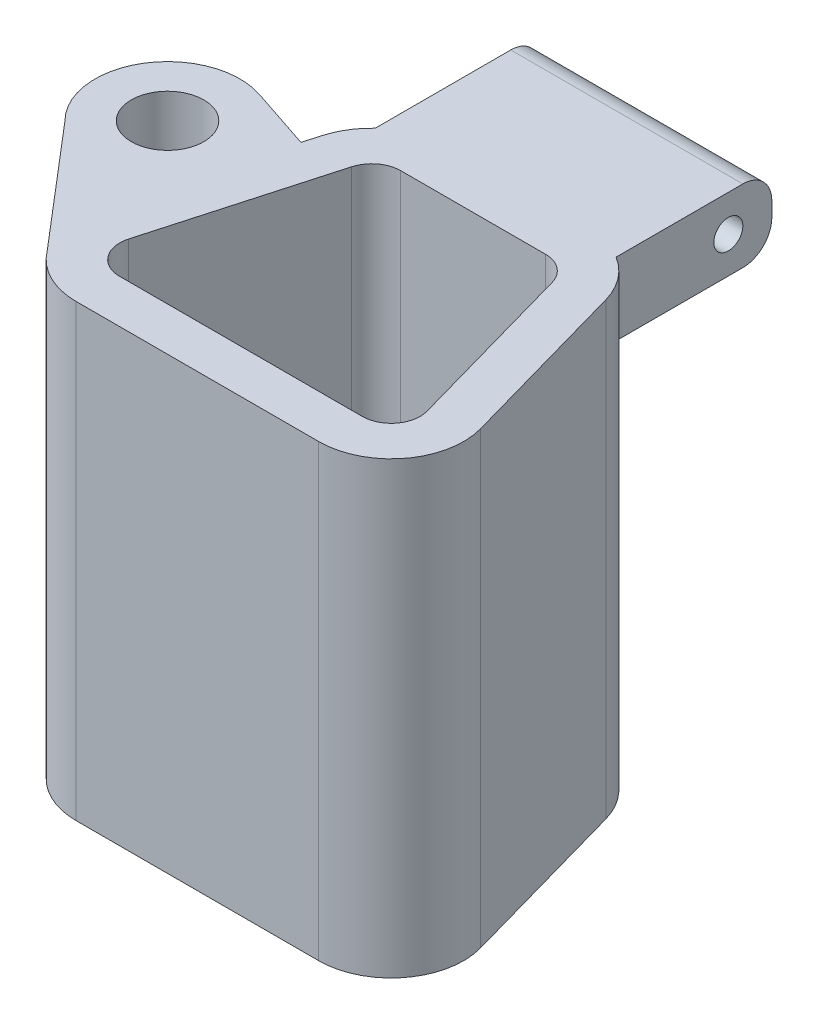
from build123d import *

# Parameters (mm, degrees)
BOSS_EXTRUDE1_DEPTH             = 31
SKETCH2_W                       = 16
SKETCH2_H                       = 5
BOSS_EXTRUDE2_DEPTH             = 10
BOSS_EXTRUDE2_DIRECTION_2_REACH = 42.293
SKETCH3_R                       = 1
CUT_EXTRUDE1_DEPTH              = 44.306250579
FILLET1_R                       = 2
SKETCH4_R                       = 2.5
BOSS_EXTRUDE3_DEPTH             = 31
SKETCH6_W                       = 18.969126519
SKETCH6_H                       = 17.5
CUT_EXTRUDE2_DEPTH              = 43.163504997


with BuildPart() as part:
    # Sketch1 → Boss-Extrude1 (new body)
    with BuildSketch(Plane(origin=(0, 0, 0), x_dir=(1, 0, 0), z_dir=(0, 1, 0))):
        with BuildLine():
            Line((-8.359903733, -11), (8.359903733, -11))
            ThreePointArc((8.359903733, -11), (12.345417465, -9.01921849), (13.173158433, -4.646272115))
            Line((13.173158433, -4.646272115), (9.798158433, 7.353727885))
            ThreePointArc((9.798158433, 7.353727885), (8.004122222, 9.985513732), (4.984903733, 11))
            Line((4.984903733, 11), (-4.984903733, 11))
            ThreePointArc((-4.984903733, 11), (-8.004122222, 9.985513732), (-9.798158433, 7.353727885))
            Line((-9.798158433, 7.353727885), (-13.173158433, -4.646272115))
            ThreePointArc((-13.173158433, -4.646272115), (-12.345417465, -9.01921849), (-8.359903733, -11))
        make_face()
        with BuildLine():
            Line((-8.359903733, -8), (8.359903733, -8))
            ThreePointArc((8.359903733, -8), (9.954109226, -7.207687396), (10.285205613, -5.458508846))
            Line((10.285205613, -5.458508846), (6.910205613, 6.541491154))
            ThreePointArc((6.910205613, 6.541491154), (6.192591129, 7.594205493), (4.984903733, 8))
            Line((4.984903733, 8), (-4.984903733, 8))
            ThreePointArc((-4.984903733, 8), (-6.192591129, 7.594205493), (-6.910205613, 6.541491154))
            Line((-6.910205613, 6.541491154), (-10.285205613, -5.458508846))
            ThreePointArc((-10.285205613, -5.458508846), (-9.954109226, -7.207687396), (-8.359903733, -8))
        make_face(mode=Mode.SUBTRACT)
    extrude(amount=BOSS_EXTRUDE1_DEPTH)

    # Sketch2 → Boss-Extrude2 (add)
    with BuildSketch(Plane(origin=(0, 0, -11), x_dir=(-1, 0, 0), z_dir=(0, 0, -1))):
        with Locations((0.398573677, 28.5)):
            Rectangle(SKETCH2_W, SKETCH2_H)
    extrude(amount=BOSS_EXTRUDE2_DEPTH)

    # Boss-Extrude2 direction 2: up to this face of the body (flat: up to its plane)
    boss_extrude2_direction_2_end = Plane(part.part.faces().sort_by_distance((0, 15.5, -8))[0])
    # Sketch2 → Boss-Extrude2 direction 2 (add, up to the picked face)
    with BuildSketch(Plane(origin=(0, 0, -11), x_dir=(-1, 0, 0), z_dir=(0, 0, -1)), mode=Mode.PRIVATE) as boss_extrude2_direction_2_sk1:
        with Locations((0.398573677, 28.5)):
            Rectangle(SKETCH2_W, SKETCH2_H)
    boss_extrude2_direction_2_tool1 = split(extrude(boss_extrude2_direction_2_sk1.sketch, amount=-BOSS_EXTRUDE2_DIRECTION_2_REACH, mode=Mode.PRIVATE), bisect_by=boss_extrude2_direction_2_end, keep=Keep.BOTH, mode=Mode.PRIVATE)
    add(boss_extrude2_direction_2_tool1.solids().sort_by(Axis((-0.398574, 28.5, -11), (0, 0, 1)))[0])

    # Sketch3 → Cut-Extrude1 (cut, through all)
    with BuildSketch(Plane.ZY.offset(8.398573677)):
        with Locations((-18, 28.5)):
            Circle(SKETCH3_R)
    extrude(amount=-CUT_EXTRUDE1_DEPTH, mode=Mode.SUBTRACT)

    # Fillet1
    fillet1_edges = [part.edges().sort_by_distance(p)[0] for p in [
        (-0.398573677, 31, -21),
        (-0.398573677, 26, -21),
    ]]
    fillet(fillet1_edges, radius=FILLET1_R)

    # Sketch4 → Boss-Extrude3 (add, through all)
    with BuildSketch(Plane(origin=(0, 31, 0), x_dir=(1, 0, 0), z_dir=(0, 1, 0))):
        with BuildLine():
            Line((-19.535533906, -0.596593374), (-12.345417465, -9.01921849))
            Line((-12.345417465, -9.01921849), (-10.109189958, 6.247838019))
            Line((-10.109189958, 6.247838019), (-14.420879995, 7.683029487))
            ThreePointArc((-14.420879995, 7.683029487), (-20.253813291, 5.566690993), (-19.535533906, -0.596593374))
        make_face()
        with Locations(Location((-16, 2.938940532, 0), (0, 0, 270))):
            Circle(SKETCH4_R, mode=Mode.SUBTRACT)
    extrude(amount=-BOSS_EXTRUDE3_DEPTH)

    # Sketch6 → Cut-Extrude2 (cut, through all)
    with BuildSketch(Plane(origin=(0.863884459, 0, -2.595334559), x_dir=(-0.9488177909602633, 0, -0.31582400092026913), z_dir=(0.31582400092026913, 0, -0.9488177909602633))):
        with Locations((21.109272612, 15.5)):
            Rectangle(SKETCH6_W, SKETCH6_H)
    extrude(amount=-CUT_EXTRUDE2_DEPTH, mode=Mode.SUBTRACT)


solid = part.part
